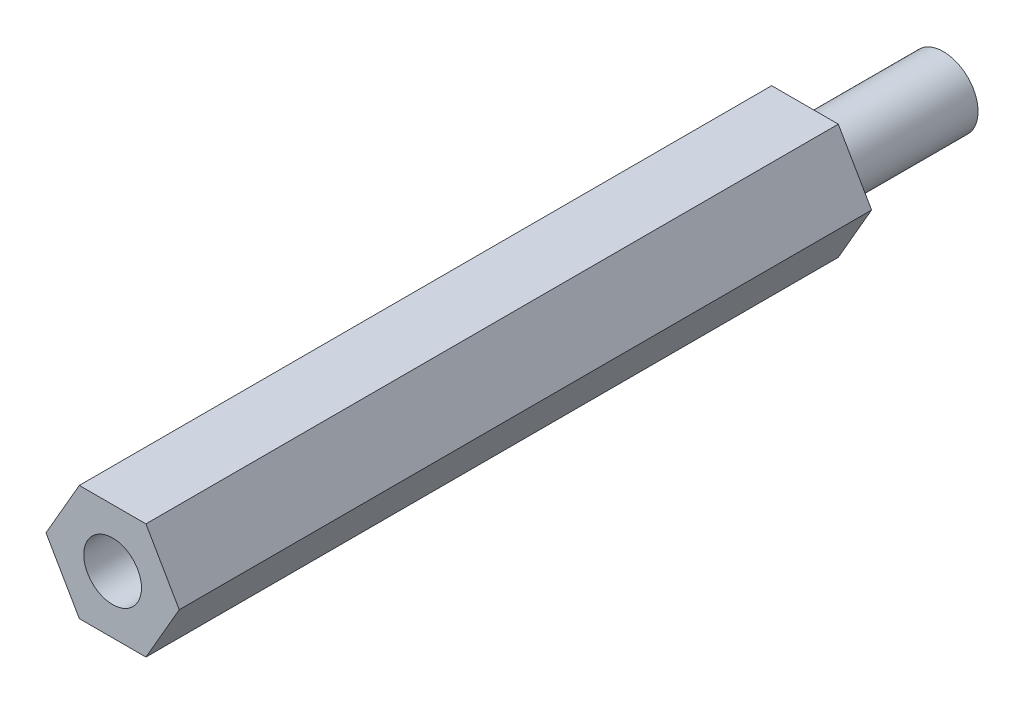
from build123d import *

# Parameters (mm, degrees)
EXTRUDE_1_DEPTH = 30
SKETCH_4_R      = 1.5
EXTRUDE_2_DEPTH = 6
M3X0_5_1_D      = 2.5
M3X0_5_1_DEPTH  = 7.5
M3X0_5_1_TIP    = 0.751075774


with BuildPart() as part:
    # 草圖1 → 填料-伸長1 (new body)
    with BuildSketch(Plane.XY):
        Polygon((-1.443375673, 2.5), (-2.886751346, 0), (-1.443375673, -2.5), (1.443375673, -2.5), (2.886751346, 0), (1.443375673, 2.5), align=None)
    extrude(amount=EXTRUDE_1_DEPTH)

    # 草圖4 → 填料-伸長2 (add)
    with BuildSketch(Plane(origin=(0, 0, 0), x_dir=(-1, 0, 0), z_dir=(0, 0, -1))):
        Circle(SKETCH_4_R)
    extrude(amount=EXTRUDE_2_DEPTH)

    # M3x0.5 螺紋孔1
    with Locations(Plane.XY.offset(30)):
        with Locations((0, 0)):
            Hole(M3X0_5_1_D / 2, depth=M3X0_5_1_DEPTH)
            with Locations((0, 0, -(M3X0_5_1_DEPTH + M3X0_5_1_TIP / 2))):  # 118° drill point
                Cone(0, M3X0_5_1_D / 2, M3X0_5_1_TIP, mode=Mode.SUBTRACT)


solid = part.part
